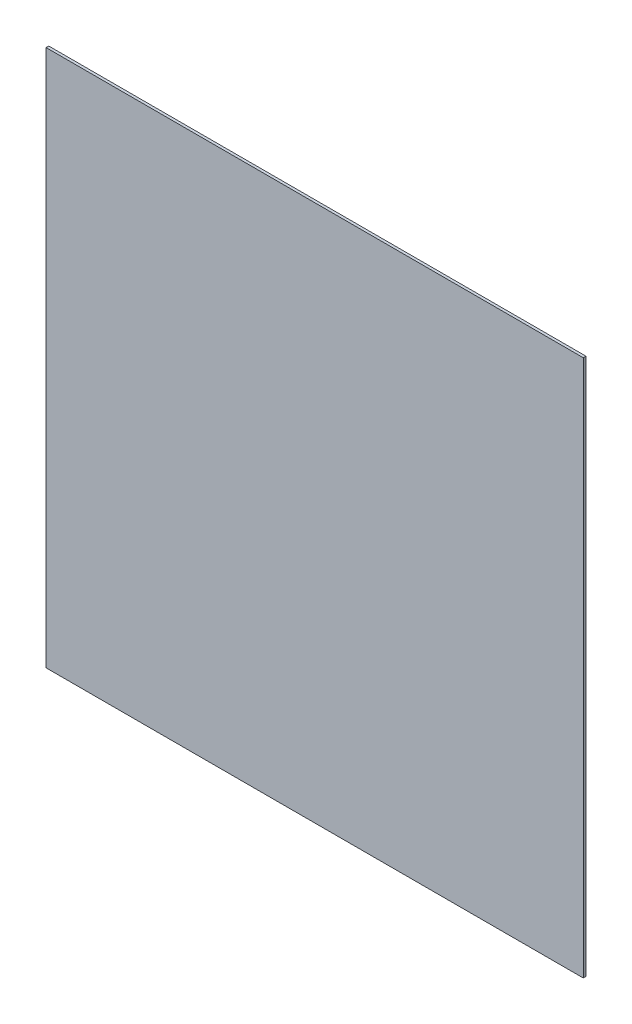
from build123d import *

# Parameters (mm, degrees)
SKETCH1_W           = 1000
SKETCH1_H           = 1000
BOSS_EXTRUDE1_DEPTH = 5


with BuildPart() as part:
    # Sketch1 → Boss-Extrude1 (new body)
    with BuildSketch(Plane.XY):
        with Locations((-196.145124717, -405.328798186)):
            Rectangle(SKETCH1_W, SKETCH1_H)
    extrude(amount=BOSS_EXTRUDE1_DEPTH)


solid = part.part
